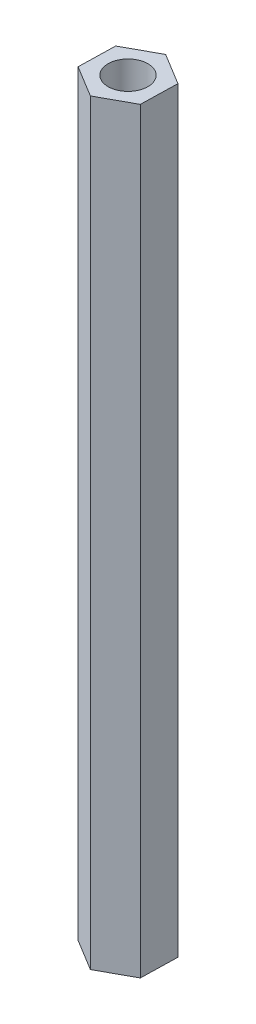
from build123d import *

# Parameters (mm, degrees)
BOSS_EXTRUDE1_DEPTH = 47.5
CUT_EXTRUDE1_START  = 48
SKETCH1_3_R         = 2.5
CUT_EXTRUDE1_DEPTH  = 14
CUT_EXTRUDE2_START  = -34
SKETCH1_4_R         = 2.5
CUT_EXTRUDE2_DEPTH  = 14


with BuildPart() as part:
    # Sketch1 → Boss-Extrude1 (new, symmetric)
    with BuildSketch(Plane(origin=(0, 0, 0), x_dir=(1, 0, 0), z_dir=(0, 1, 0))):
        Polygon((4.052090098, 2.216731642), (0.106299134, 4.617578784), (-3.945790964, 2.400847142), (-4.052090098, -2.216731642), (-0.106299134, -4.617578784), (3.945790964, -2.400847142), align=None)
    extrude(amount=BOSS_EXTRUDE1_DEPTH, both=True)

    # Sketch1<3> → Cut-Extrude1 (cut)
    with BuildSketch(Plane(origin=(0, 0, 0), x_dir=(1, 0, 0), z_dir=(0, 1, 0)).offset(CUT_EXTRUDE1_START)):
        with Locations(Location((0, 0, 0), (0, 0, 270))):
            Circle(SKETCH1_3_R)
    extrude(amount=-CUT_EXTRUDE1_DEPTH, mode=Mode.SUBTRACT)

    # Sketch1<4> → Cut-Extrude2 (cut)
    with BuildSketch(Plane(origin=(0, 0, 0), x_dir=(1, 0, 0), z_dir=(0, 1, 0)).offset(CUT_EXTRUDE2_START)):
        with Locations(Location((0, 0, 0), (0, 0, 270))):
            Circle(SKETCH1_4_R)
    extrude(amount=-CUT_EXTRUDE2_DEPTH, mode=Mode.SUBTRACT)


solid = part.part
